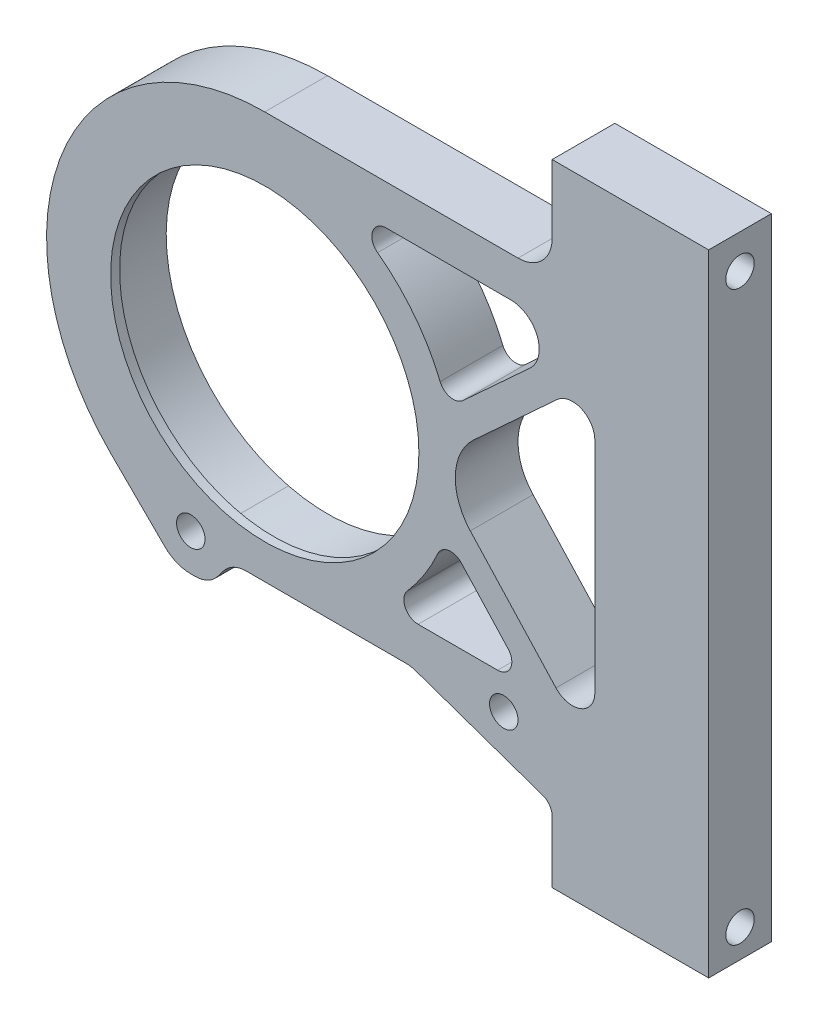
from build123d import *

# Parameters (mm, degrees)
BOSS_EXTRUDE1_DEPTH      = 8
BOSS_EXTRUDE1_DEPTH_BACK = 6
SKETCH1_R                = 36
SKETCH1_R_2              = 3.175
BOSS_EXTRUDE2_START      = -2
SKETCH3_R                = 36
SKETCH3_R_2              = 34.4
BOSS_EXTRUDE2_DEPTH      = 2
SKETCH4_R                = 3.175
CUT_EXTRUDE1_DEPTH       = 3267.782082753
FILLET11_R               = 12.7
CUT_EXTRUDE2_DEPTH       = 22.352
FILLET13_R               = 7.62
BOSS_EXTRUDE5_DEPTH      = 14
FILLET16_R               = 6.35
FILLET17_R               = 3.175
SKETCH10_W               = 14
SKETCH10_H               = 38.1
SKETCH10_R               = 3.175
SKETCH10_H_2             = 29.591
BOSS_EXTRUDE6_DEPTH      = 25.4
BOSS_EXTRUDE7_REACH      = 3394.349
SKETCH11_W               = 25.4
SKETCH11_H               = 14
FILLET18_R               = 5


with BuildPart() as part:
    # Sketch1 → Boss-Extrude1 (new, two sides: drawn at the far end of the back side and taken through both)
    with BuildSketch(Plane(origin=(-1819.591456758, 1585.913991712, -2825.111273399), x_dir=(1, 0, 0), z_dir=(0, 0, 1)).offset(-BOSS_EXTRUDE1_DEPTH_BACK)):
        with BuildLine():
            Line((2.684706364, 17.24642532), (66.819706364, 17.24642532))
            Line((66.819706364, 17.24642532), (66.819706364, 40.10642532))
            Line((66.819706364, 40.10642532), (76.344706364, 40.10642532))
            Line((76.344706364, 40.10642532), (76.344706364, 2.00642532))
            Line((76.344706364, 2.00642532), (39.954706364, -31.45357468))
            Line((39.954706364, -31.45357468), (76.344706364, -71.030146707))
            Line((76.344706364, -71.030146707), (76.344706364, -100.621146707))
            Line((76.344706364, -100.621146707), (66.819706364, -100.621146707))
            Line((66.819706364, -100.621146707), (66.819706364, -80.301146707))
            Line((66.819706364, -80.301146707), (-13.825293636, -80.301146707))
            ThreePointArc((-13.825293636, -80.301146707), (-16.969178238, -79.679037025), (-19.63920674, -77.906474293))
            Line((-19.63920674, -77.906474293), (-31.614211644, -66.026312835))
            ThreePointArc((-31.614211644, -66.026312835), (-42.345185642, -12.90636934), (2.684706364, 17.24642532))
        make_face()
        with Locations((2.684706364, -31.45357468)):
            Circle(SKETCH1_R, mode=Mode.SUBTRACT)
        with Locations((56.024706364, -72.046146707)):
            Circle(SKETCH1_R_2, mode=Mode.SUBTRACT)
        with Locations((-13.825293636, -72.046146707)):
            Circle(SKETCH1_R_2, mode=Mode.SUBTRACT)
    extrude(amount=BOSS_EXTRUDE1_DEPTH + BOSS_EXTRUDE1_DEPTH_BACK)

    # Sketch3 → Boss-Extrude2 (add)
    with BuildSketch(Plane.XY.offset(-2817.111273399).offset(BOSS_EXTRUDE2_START)):
        with Locations((-1816.906750395, 1554.460417032)):
            Circle(SKETCH3_R)
        with Locations((-1816.906750395, 1554.460417032)):
            Circle(SKETCH3_R_2, mode=Mode.SUBTRACT)
    extrude(amount=BOSS_EXTRUDE2_DEPTH)

    # Sketch4 → Cut-Extrude1 (cut, through all)
    with BuildSketch(Plane.ZY.offset(1752.771750395)):
        with Locations((-2824.111273399, 1618.400417032)):
            Circle(SKETCH4_R)
        with Locations((-2824.111273399, 1491.642845005)):
            Circle(SKETCH4_R)
    extrude(amount=-CUT_EXTRUDE1_DEPTH, mode=Mode.SUBTRACT)

    # Fillet11
    fillet11_edges = [part.edges().sort_by_distance(p)[0] for p in [
        (-1779.636750395, 1554.460417032, -2824.111273399),
    ]]
    fillet(fillet11_edges, radius=FILLET11_R)

    # Sketch6 → Cut-Extrude2 (cut)
    with BuildSketch(Plane(origin=(0, 0, -2831.111273399), x_dir=(-1, 0, 0), z_dir=(0, 0, -1))):
        with BuildLine():
            Line((1772.683835409, 1569.479812149), (1757.712123838, 1583.246052027))
            ThreePointArc((1757.712123838, 1583.246052027), (1756.093845604, 1590.22696014), (1762.010124746, 1594.270417032))
            Line((1762.010124746, 1594.270417032), (1789.841933512, 1594.270417032))
            ThreePointArc((1789.841933512, 1594.270417032), (1792.856665482, 1592.091417106), (1791.733381238, 1588.545309093))
            ThreePointArc((1791.733381238, 1588.545309093), (1783.527991751, 1580.529266005), (1777.768914276, 1570.608661686))
            ThreePointArc((1777.768914276, 1570.608661686), (1775.52091162, 1568.717450047), (1772.683835409, 1569.479812149))
        make_face()
        with BuildLine():
            Line((1782.693449915, 1521.233845005), (1764.944287612, 1521.233845005))
            ThreePointArc((1764.944287612, 1521.233845005), (1762.037080925, 1523.132610591), (1762.60710511, 1526.557845459))
            Line((1762.60710511, 1526.557845459), (1773.061547126, 1537.927754155))
            ThreePointArc((1773.061547126, 1537.927754155), (1775.907154759, 1538.912781284), (1778.29542193, 1537.07867628))
            ThreePointArc((1778.29542193, 1537.07867628), (1781.295178562, 1531.536772561), (1785.082430904, 1526.500111328))
            ThreePointArc((1785.082430904, 1526.500111328), (1785.584850577, 1523.097194437), (1782.693449915, 1521.233845005))
        make_face()
        Polygon((1824.186318893, 1512.343845005), (1784.281249696, 1512.343845005), (1764.963750395, 1505.612845005), (1752.771750395, 1505.612845005), (1752.771750395, 1485.292845005), (1829.340879649, 1505.612845005), align=None)
    extrude(amount=-CUT_EXTRUDE2_DEPTH, mode=Mode.SUBTRACT)

    # Fillet13
    fillet13_edges = [part.edges().sort_by_distance(p)[0] for p in [
        (-1752.771750395, 1603.160417032, -2824.111273399),
    ]]
    fillet(fillet13_edges, radius=FILLET13_R)

    # Sketch9 → Boss-Extrude5 (add)
    with BuildSketch(Plane.XY.offset(-2817.111273399)):
        Polygon((-1764.963750395, 1505.612845005), (-1752.771750395, 1505.612845005), (-1752.771750395, 1501.364657871), align=None)
    extrude(amount=-BOSS_EXTRUDE5_DEPTH)

    # Fillet16
    fillet16_edges = [part.edges().sort_by_distance(p)[0] for p in [
        (-1824.186318893, 1512.343845005, -2824.111273399),
        (-1829.340879649, 1505.612845005, -2824.111273399),
        (-1784.281249696, 1512.343845005, -2824.111273399),
    ]]
    fillet(fillet16_edges, radius=FILLET16_R)

    # Fillet17
    fillet17_edges = [part.edges().sort_by_distance(p)[0] for p in [
        (-1752.771750395, 1501.364657871, -2824.111273399),
    ]]
    fillet(fillet17_edges, radius=FILLET17_R)

    # Sketch10 → Boss-Extrude6 (add)
    # profile 1 of 2: a face of its own
    with BuildSketch(Plane(origin=(-1743.246750395, 0, 0), x_dir=(0, 0, -1), z_dir=(1, 0, 0))):
        with Locations((2824.111273399, 1606.970417032)):
            Rectangle(SKETCH10_W, SKETCH10_H)
        with Locations(Location((2824.111273399, 1618.400417032, 0), (0, 0, 180))):
            Circle(SKETCH10_R, mode=Mode.SUBTRACT)
    # profile 2 of 2: a face of its own
    with BuildSketch(Plane(origin=(-1743.246750395, 0, 0), x_dir=(0, 0, -1), z_dir=(1, 0, 0))):
        with Locations((2824.111273399, 1500.088345005)):
            Rectangle(SKETCH10_W, SKETCH10_H_2)
        with Locations(Location((2824.111273399, 1491.642845005, 0), (0, 0, 180))):
            Circle(SKETCH10_R, mode=Mode.SUBTRACT)
    extrude(amount=BOSS_EXTRUDE6_DEPTH)

    # Boss-Extrude7: up to this plane
    boss_extrude7_end = Plane(origin=(-1743.246750395, 1587.920417032, -2831.111273399), z_dir=(0.6768505367088385, -0.7361204731271623, 0))
    # Sketch11 → Boss-Extrude7 (add, up to the surface)
    with BuildSketch(Plane(origin=(0, 1514.883845005, 0), x_dir=(1, 0, 0), z_dir=(0, 1, 0)), mode=Mode.PRIVATE) as boss_extrude7_sk1:
        with Locations((-1730.546750395, 2824.111273399)):
            Rectangle(SKETCH11_W, SKETCH11_H)
    boss_extrude7_tool1 = split(extrude(boss_extrude7_sk1.sketch, amount=BOSS_EXTRUDE7_REACH, mode=Mode.PRIVATE), bisect_by=boss_extrude7_end, keep=Keep.BOTH, mode=Mode.PRIVATE)
    add(boss_extrude7_tool1.solids().sort_by_distance((-1730.54675, 1514.883845, -2824.111273))[0])

    # Fillet18
    fillet18_edges = [part.edges().sort_by_distance(p)[0] for p in [
        (-1743.246750395, 1587.920417032, -2824.111273399),
        (-1743.246750395, 1514.883845005, -2824.111273399),
    ]]
    fillet(fillet18_edges, radius=FILLET18_R)


solid = part.part
